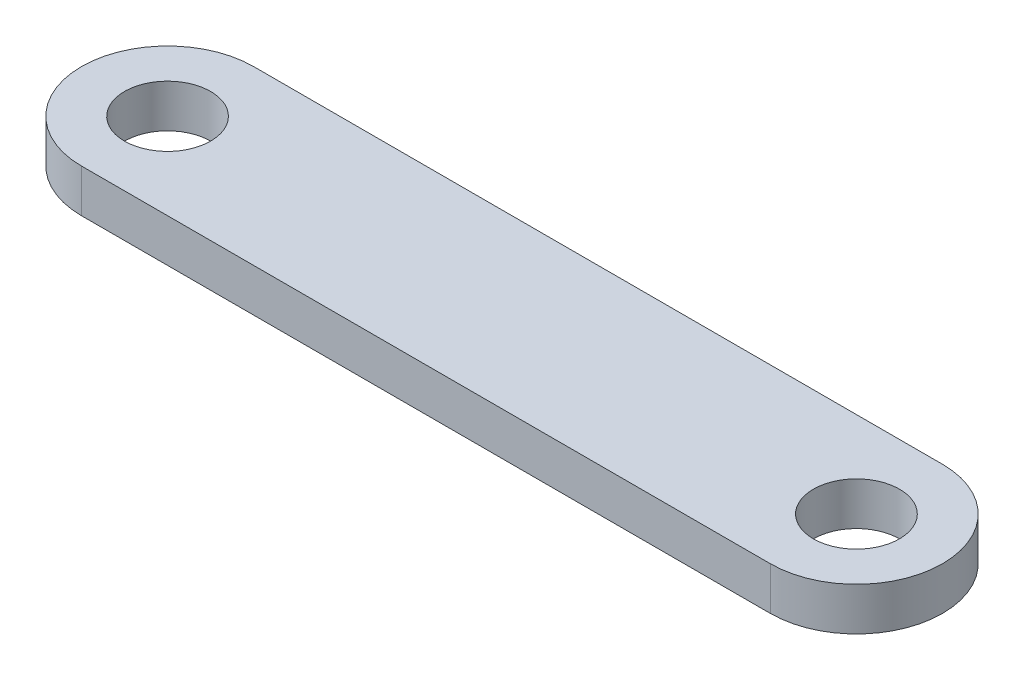
from build123d import *

# Parameters (mm, degrees)
SKETCH1_R           = 2
BOSS_EXTRUDE1_DEPTH = 1


with BuildPart() as part:
    # Sketch1 → Boss-Extrude1 (new, symmetric)
    with BuildSketch(Plane(origin=(0, 0, 0), x_dir=(1, 0, 0), z_dir=(0, 1, 0))):
        with BuildLine():
            Line((-16, 4), (16, 4))
            ThreePointArc((16, 4), (20, 0), (16, -4))
            Line((16, -4), (-16, -4))
            ThreePointArc((-16, -4), (-20, 0), (-16, 4))
        make_face()
        with Locations(Location((-16, 0, 0), (0, 0, 270))):
            Circle(SKETCH1_R, mode=Mode.SUBTRACT)
        with Locations(Location((16, 0, 0), (0, 0, 270))):
            Circle(SKETCH1_R, mode=Mode.SUBTRACT)
    extrude(amount=BOSS_EXTRUDE1_DEPTH, both=True)


solid = part.part
